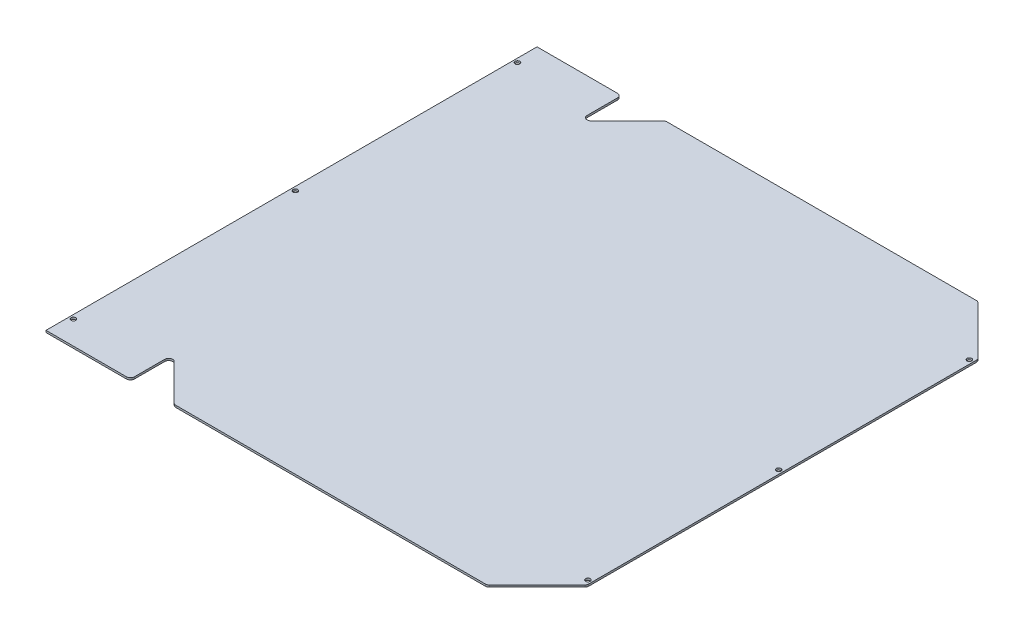
from build123d import *

# Parameters (mm, degrees)
BOSS_EXTRUDE1_DEPTH   = 1.5875
F_6_CLEARANCE_HOLE1_D = 3.7973
FILLET1_R             = 3.175


with BuildPart() as part:
    # Sketch1 → Boss-Extrude1 (new body)
    with BuildSketch(Plane(origin=(0, 0, 0), x_dir=(1, 0, 0), z_dir=(0, 1, 0))):
        Polygon((199.39, 158.75), (158.75, 199.39), (-95.25, 199.39), (-130.81, 163.83), (-130.81, 199.39), (-199.39, 199.39), (-199.39, -199.39), (-130.81, -199.39), (-130.81, -163.83), (-95.25, -199.39), (158.75, -199.39), (199.39, -158.75), align=None)
    extrude(amount=-BOSS_EXTRUDE1_DEPTH)

    # #6 Clearance Hole1 (through all)
    with Locations(Plane(origin=(0, -1.5875, 0), x_dir=(-1, 0, 0), z_dir=(0, -1, 0))):
        with Locations((196.215, 180.34), (196.215, -180.34), (-196.215, -154.94), (-196.215, 154.94), (196.215, 0), (-196.215, 0)):
            Hole(F_6_CLEARANCE_HOLE1_D / 2)

    # Fillet1
    fillet1_edges = [part.edges().sort_by_distance(p)[0] for p in [
        (-130.81, -0.79375, 199.39),
        (-130.81, -0.79375, -199.39),
        (-130.81, -0.79375, -163.83),
        (-95.25, -0.79375, -199.39),
        (158.75, -0.79375, -199.39),
        (199.39, -0.79375, -158.75),
        (199.39, -0.79375, 158.75),
        (158.75, -0.79375, 199.39),
        (-95.25, -0.79375, 199.39),
        (-130.81, -0.79375, 163.83),
    ]]
    fillet(fillet1_edges, radius=FILLET1_R)


solid = part.part
